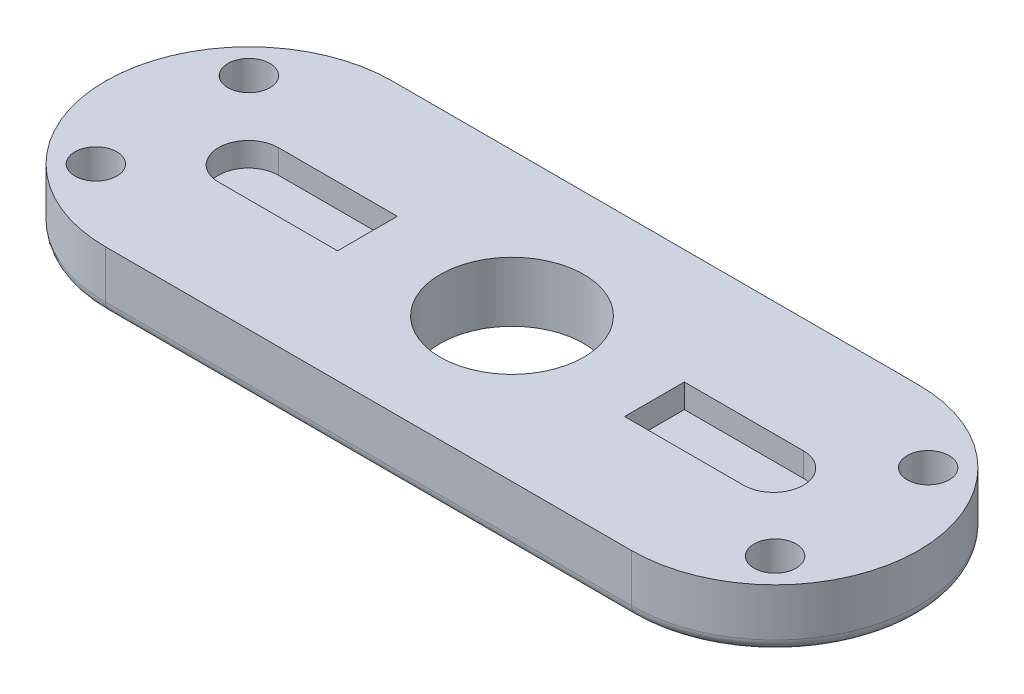
from build123d import *

# Parameters (mm, degrees)
BOSS_EXTRUDE1_DEPTH = 6.35
CUT_EXTRUDE1_DEPTH  = 2.54
SKETCH3_R           = 7.62
CUT_EXTRUDE2_DEPTH  = 47.228697797
FILLET1_R           = 1.27
SKETCH4_R           = 2.23393
CUT_EXTRUDE3_DEPTH  = 47.228697923


with BuildPart() as part:
    # Sketch1 → Boss-Extrude1 (new body)
    with BuildSketch(Plane(origin=(0, 0, 0), x_dir=(1, 0, 0), z_dir=(0, 1, 0))):
        with BuildLine():
            Line((27.94, 15.24), (-27.94, 15.24))
            ThreePointArc((-27.94, 15.24), (-43.18, 0), (-27.94, -15.24))
            Line((-27.94, -15.24), (27.94, -15.24))
            ThreePointArc((27.94, -15.24), (43.18, 0), (27.94, 15.24))
        make_face()
    extrude(amount=BOSS_EXTRUDE1_DEPTH)

    # Sketch2 → Cut-Extrude1 (cut)
    with BuildSketch(Plane(origin=(0, 6.35, 0), x_dir=(1, 0, 0), z_dir=(0, 1, 0))):
        with BuildLine():
            Line((-15.24, 3.063440359), (-27.882747925, 3.063440359))
            ThreePointArc((-27.882747925, 3.063440359), (-31.057747925, -0.111559641), (-27.882747925, -3.286559641))
            Line((-27.882747925, -3.286559641), (-15.24, -3.286559641))
            Line((-15.24, -3.286559641), (-15.24, 3.063440359))
        make_face()
        with BuildLine():
            Line((15.24, 3.063440359), (15.24, -3.286559641))
            Line((15.24, -3.286559641), (27.882747925, -3.286559641))
            ThreePointArc((27.882747925, -3.286559641), (31.057747925, -0.111559641), (27.882747925, 3.063440359))
            Line((27.882747925, 3.063440359), (15.24, 3.063440359))
        make_face()
    extrude(amount=-CUT_EXTRUDE1_DEPTH, mode=Mode.SUBTRACT)

    # Sketch3 → Cut-Extrude2 (cut, through all)
    with BuildSketch(Plane(origin=(0, 6.35, 0), x_dir=(1, 0, 0), z_dir=(0, 1, 0))):
        with Locations(Location((0, 0, 0), (0, 0, 270))):
            Circle(SKETCH3_R)
    extrude(amount=-CUT_EXTRUDE2_DEPTH, mode=Mode.SUBTRACT)

    # Fillet1
    fillet1_edges = [part.edges().sort_by_distance(p)[0] for p in [
        (0, 0, -15.24),
        (43.18, 0, 0),
        (0, 0, 15.24),
        (-43.18, 0, 0),
    ]]
    fillet(fillet1_edges, radius=FILLET1_R)

    # Sketch4 → Cut-Extrude3 (cut, through all)
    with BuildSketch(Plane(origin=(0, 6.35, 0), x_dir=(1, 0, 0), z_dir=(0, 1, 0))):
        with Locations(Location((-36.068, 8.128, 0), (0, 0, 270))):
            Circle(SKETCH4_R)
        with Locations(Location((-36.068, -8.128, 0), (0, 0, 270))):
            Circle(SKETCH4_R)
        with Locations(Location((36.068, 8.128, 0), (0, 0, 90))):
            Circle(SKETCH4_R)
        with Locations(Location((36.068, -8.128, 0), (0, 0, 90))):
            Circle(SKETCH4_R)
    extrude(amount=-CUT_EXTRUDE3_DEPTH, mode=Mode.SUBTRACT)


solid = part.part
